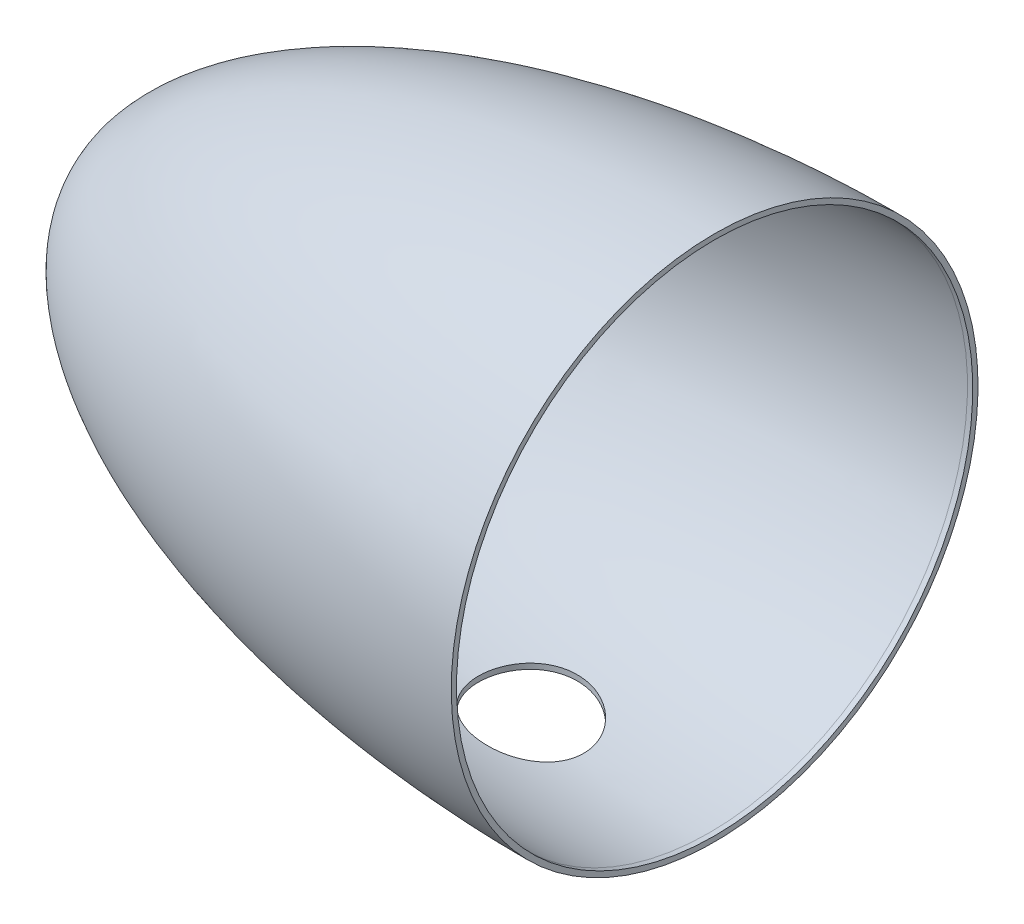
from build123d import *

# Parameters (mm, degrees)
SKETCH19_R         = 30
CUT_EXTRUDE1_DEPTH = 281


with BuildPart() as part:
    # Sketch18 → Revolve16 (revolve)
    with BuildSketch(Plane.XY):
        with BuildLine():
            Line((-3, 146.994469377), (0, 146.994469377))
            Line((0, 146.994469377), (0, 150))
            add(Edge.make_bspline(
                [(0, 150), (-350, 150), (-350, 0)],
                knots=[1.570796327, 1.570796327, 1.570796327, 3.141592654, 3.141592654, 3.141592654], degree=2, weights=[1, 0.707106781, 1]))
            Line((-350, 0), (-346.926567102, 0))
            Line((-346.926567102, 0), (-346.926567102, 3))
            add(Edge.make_bspline(
                [(-346.926567102, 3), (-346.813727301, 5.304758817), (-346.331578229, 9.881868798), (-344.331694511, 19.0575247), (-339.887273399, 30.474164748), (-331.432386108, 44.008781696), (-316.046042328, 61.639025315), (-289.294666984, 82.518694154), (-246.320556553, 104.604502967), (-194.113298987, 122.809254685), (-144.553080527, 134.145306344), (-102.392138924, 140.653620406), (-69.809895655, 144.210411462), (-36.588323356, 146.408003651), (-14.177412171, 146.953256578), (-3, 146.994469377)],
                knots=[-1.562193188, -1.562193188, -1.562193188, -1.562193188, -1.514030262, -1.465867336, -1.369541484, -1.273215632, -1.17688978, -0.984238077, -0.791586373, -0.598934669, -0.406282965, -0.309957113, -0.213631261, -0.117305409, -0.020979557, -0.020979557, -0.020979557, -0.020979557], degree=3))
        make_face()
    revolve(axis=Axis((0, 0, 0), (-1, 0, 0)))

    # Sketch19 → Cut-Extrude1 (cut)
    with BuildSketch(Plane(origin=(0, 0, 0), x_dir=(1, 0, 0), z_dir=(0, 1, 0))):
        with Locations(Location((-104.50918794, 0, 0), (0, 0, 270))):
            Circle(SKETCH19_R)
    extrude(amount=-CUT_EXTRUDE1_DEPTH, mode=Mode.SUBTRACT)


solid = part.part
